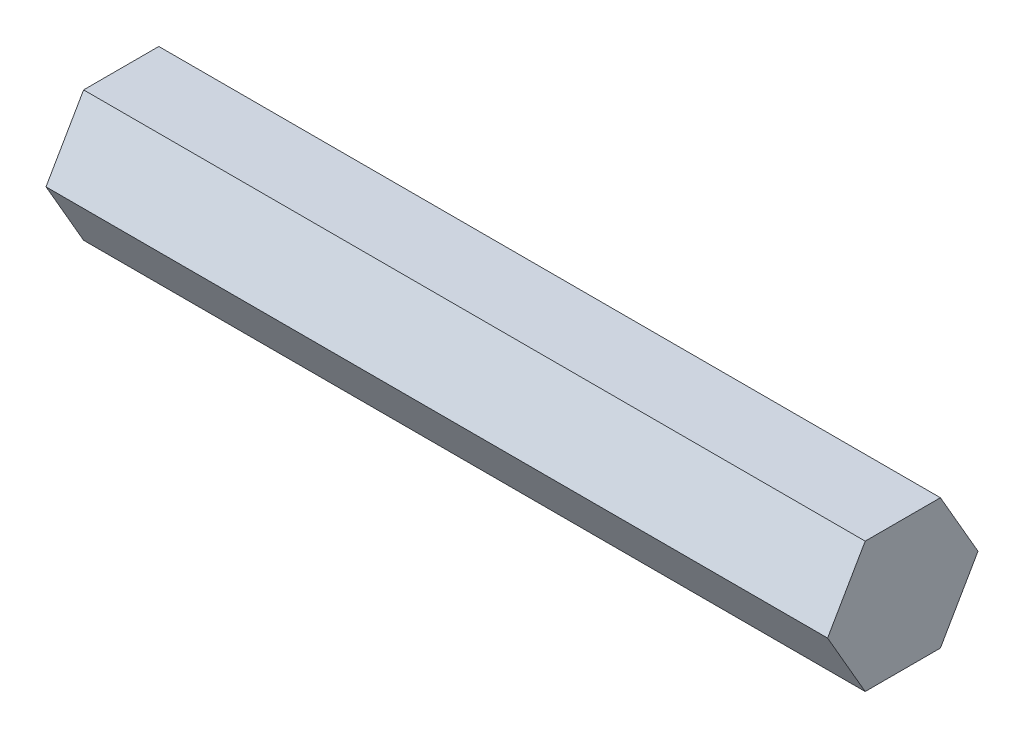
from build123d import *

# Parameters (mm, degrees)
BOSS_EXTRUDE1_DEPTH = 76.2


with BuildPart() as part:
    # Sketch1 → Boss-Extrude1 (new body)
    with BuildSketch(Plane(origin=(0, 0, 0), x_dir=(0, 0, -1), z_dir=(1, 0, 0))):
        Polygon((-7.332348419, 0), (-3.666174209, -6.35), (3.666174209, -6.35), (7.332348419, 0), (3.666174209, 6.35), (-3.666174209, 6.35), align=None)
    extrude(amount=BOSS_EXTRUDE1_DEPTH)


solid = part.part
